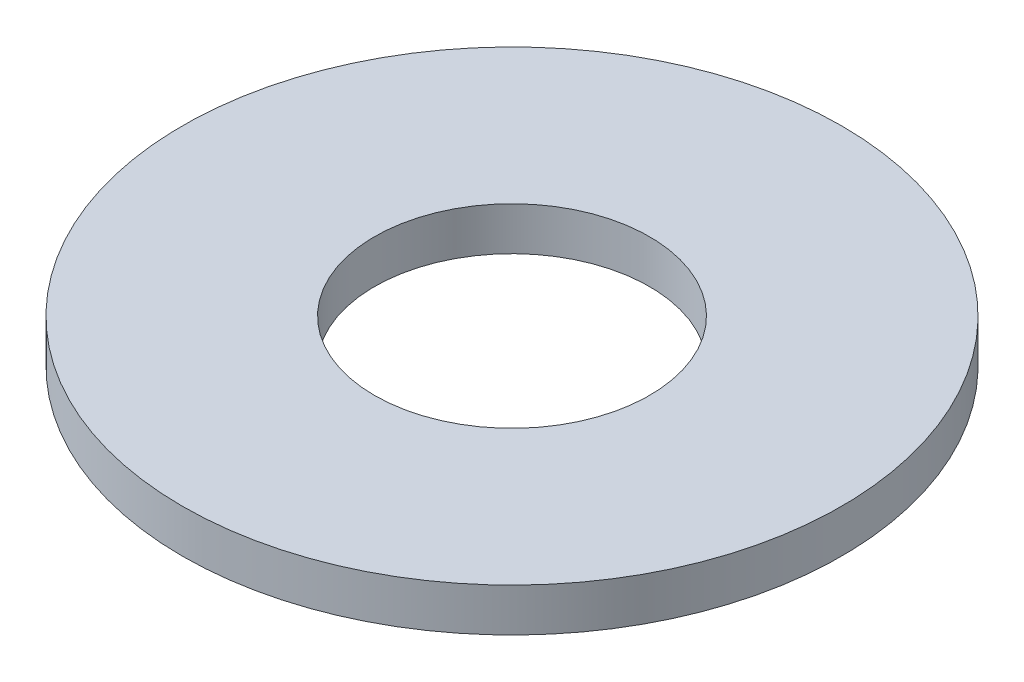
from build123d import *

# Parameters (mm, degrees)
SKETCH1_R           = 38.1
SKETCH1_R_2         = 15.9
BOSS_EXTRUDE1_DEPTH = 5


with BuildPart() as part:
    # Sketch1 → Boss-Extrude1 (new body)
    with BuildSketch(Plane(origin=(0, 0, 0), x_dir=(1, 0, 0), z_dir=(0, 1, 0))):
        with Locations(Location((0, 0, 0), (0, 0, 270))):
            Circle(SKETCH1_R)
        with Locations(Location((0, 0, 0), (0, 0, 270))):
            Circle(SKETCH1_R_2, mode=Mode.SUBTRACT)
    extrude(amount=BOSS_EXTRUDE1_DEPTH)


solid = part.part
